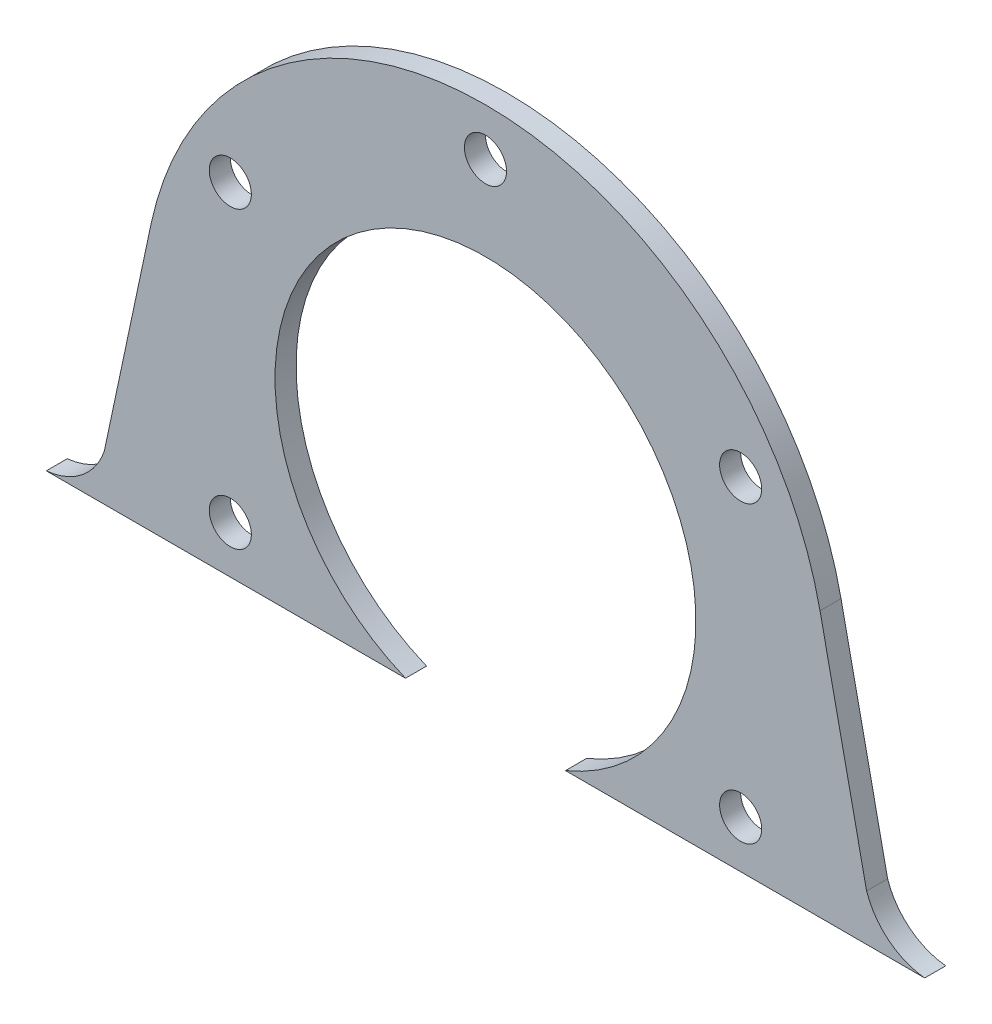
from build123d import *

# Parameters (mm, degrees)
SKETCH1_R           = 20
SKETCH1_R_2         = 2
SKETCH1_R_3         = 2.5
BOSS_EXTRUDE1_DEPTH = 2
SKETCH2_W           = 100.062981373
SKETCH2_H           = 60.5
CUT_EXTRUDE1_DEPTH  = 10
BOSS_EXTRUDE2_DEPTH = 2


with BuildPart() as part:
    # Sketch1 → Boss-Extrude1 (new body)
    with BuildSketch(Plane.XY):
        with BuildLine():
            Line((-50, -79), (50, -79))
            Line((50, -79), (31.791156311, 6.750731842))
            ThreePointArc((31.791156311, 6.750731842), (0, 32.5), (-31.791156311, 6.750731842))
            Line((-31.791156311, 6.750731842), (-50, -79))
        make_face()
        Circle(SKETCH1_R, mode=Mode.SUBTRACT)
        with Locations((0, 28)):
            Circle(SKETCH1_R_2, mode=Mode.SUBTRACT)
        with Locations((24.248711306, 14)):
            Circle(SKETCH1_R_2, mode=Mode.SUBTRACT)
        with Locations((24.248711306, -14)):
            Circle(SKETCH1_R_2, mode=Mode.SUBTRACT)
        with Locations((-24.248711306, -14)):
            Circle(SKETCH1_R_2, mode=Mode.SUBTRACT)
        with Locations((-24.248711306, 14)):
            Circle(SKETCH1_R_2, mode=Mode.SUBTRACT)
        with Locations((0, -71.5)):
            Circle(SKETCH1_R_3, mode=Mode.SUBTRACT)
        with Locations((23, -46.5)):
            Circle(SKETCH1_R_3, mode=Mode.SUBTRACT)
        with Locations((-23, -46.5)):
            Circle(SKETCH1_R_3, mode=Mode.SUBTRACT)
    extrude(amount=BOSS_EXTRUDE1_DEPTH)

    # Sketch2 → Cut-Extrude1 (cut)
    with BuildSketch(Plane(origin=(0, 0, 0), x_dir=(-1, 0, 0), z_dir=(0, 0, -1))):
        with Locations((0.031490687, -48.75)):
            Rectangle(SKETCH2_W, SKETCH2_H)
    extrude(amount=-CUT_EXTRUDE1_DEPTH, mode=Mode.SUBTRACT)

    # Sketch3 → Boss-Extrude2 (add)
    with BuildSketch(Plane.XY.offset(2)):
        with BuildLine():
            Line((-36.218763373, -14.100155361), (-37.153053746, -18.5))
            Line((-37.153053746, -18.5), (-41.739173899, -18.5))
            ThreePointArc((-41.739173899, -18.5), (-38.327081149, -17.117989866), (-36.218763373, -14.100155361))
        make_face()
    boss_extrude2 = extrude(amount=-BOSS_EXTRUDE2_DEPTH)

    # Mirror1: Boss-Extrude2 across plane
    add(boss_extrude2.mirror(Plane(origin=(0, 0, 0), x_dir=(0, 0, 1), z_dir=(1, 0, 0))))


solid = part.part
